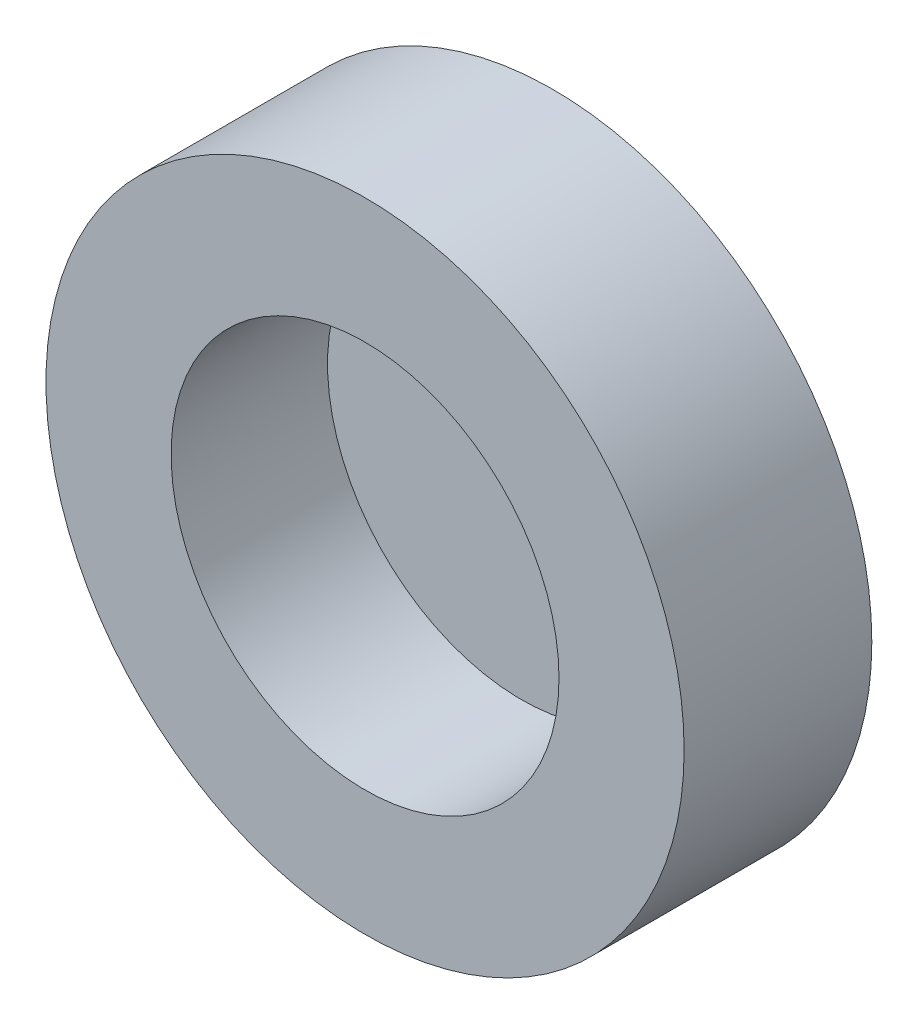
from build123d import *

# Parameters (mm, degrees)
SKETCH_1_R          = 1
EXTRUDE_1_DEPTH     = 5.5
SKETCH_2_R          = 5.1
EXTRUDE_2_DEPTH     = 3
SKETCH_3_R          = 3.1
CUT_EXTRUDE_1_DEPTH = 2.5


with BuildPart() as part:
    # 草图1 → 凸台-拉伸1 (new body)
    with BuildSketch(Plane.XY):
        Circle(SKETCH_1_R)
    extrude(amount=EXTRUDE_1_DEPTH)

    # 草图2 → 凸台-拉伸2 (add)
    with BuildSketch(Plane.XY.offset(5.5)):
        Circle(SKETCH_2_R)
    extrude(amount=-EXTRUDE_2_DEPTH)

    # 草图3 → 切除-拉伸1 (cut)
    with BuildSketch(Plane.XY.offset(5.5)):
        Circle(SKETCH_3_R)
    extrude(amount=-CUT_EXTRUDE_1_DEPTH, mode=Mode.SUBTRACT)


solid = part.part
